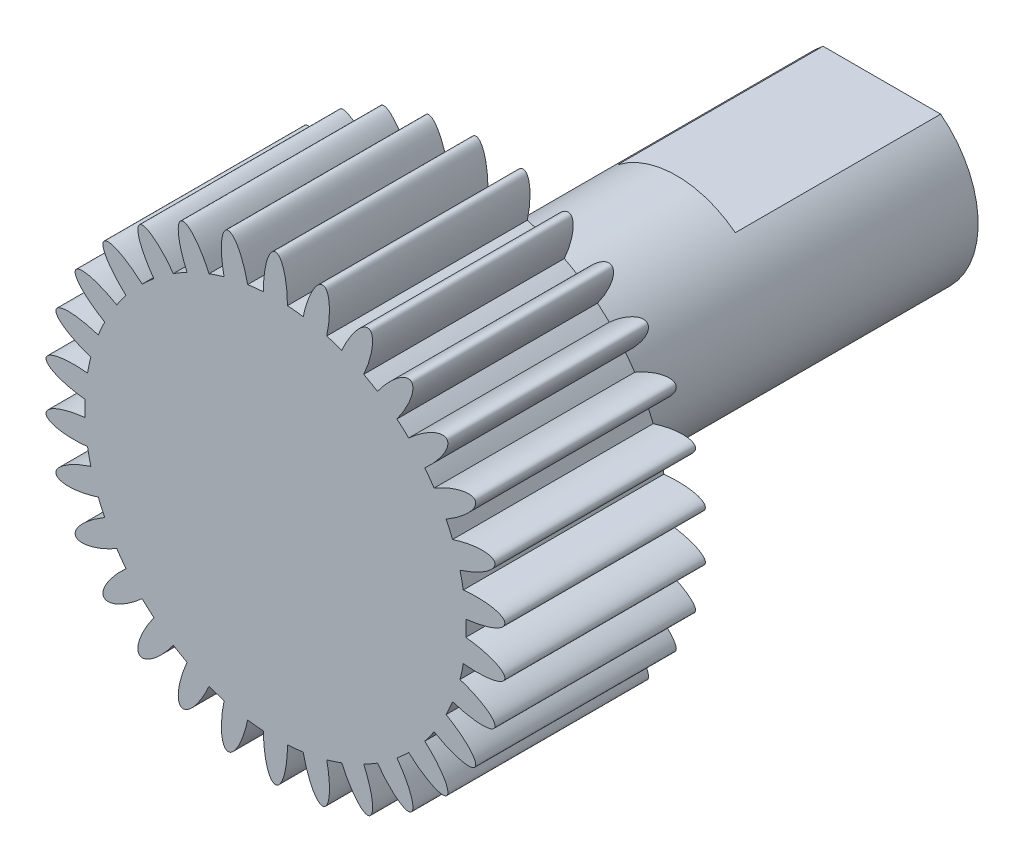
from build123d import *

# Parameters (mm, degrees)
BOSS_EXTRUDE1_DEPTH = 13
SKETCH2_R           = 6.096
BOSS_EXTRUDE2_DEPTH = 12.7
SKETCH3_R           = 12.065
BOSS_EXTRUDE3_DEPTH = 12.7
SKETCH4_RX          = 2.54
SKETCH4_RY          = 0.762
BOSS_EXTRUDE4_DEPTH = 12.7
CIRPATTERN1_COUNT   = 30


with BuildPart() as part:
    # Sketch1 → Boss-Extrude1 (new body)
    with BuildSketch(Plane.XY):
        with BuildLine():
            Line((-3.724371088, 4.826), (3.724371088, 4.826))
            ThreePointArc((3.724371088, 4.826), (0, -6.096), (-3.724371088, 4.826))
        make_face()
    extrude(amount=BOSS_EXTRUDE1_DEPTH)

    # Sketch2 → Boss-Extrude2 (add)
    with BuildSketch(Plane.XY.offset(13)):
        with Locations(Location((0, 0, 0), (0, 0, 127.658462006))):
            Circle(SKETCH2_R)
    extrude(amount=BOSS_EXTRUDE2_DEPTH)

    # Sketch3 → Boss-Extrude3 (add)
    with BuildSketch(Plane.XY.offset(25.7)):
        Circle(SKETCH3_R)
    extrude(amount=BOSS_EXTRUDE3_DEPTH)

    # Sketch4 → Boss-Extrude4 (add)
    with BuildSketch(Plane.XY.offset(38.4)):
        with Locations(Location((0, 12.065), (0, 0, 90))):
            Ellipse(SKETCH4_RX, SKETCH4_RY)
    boss_extrude4 = extrude(amount=-BOSS_EXTRUDE4_DEPTH)

    # CirPattern1: Boss-Extrude4 ×30 about axis
    cirpattern1_axis = Axis((0, 0, 44.3205), (0, 0, -1))
    for i in range(1, CIRPATTERN1_COUNT):
        add(boss_extrude4.rotate(cirpattern1_axis, i * 360 / CIRPATTERN1_COUNT))


solid = part.part
